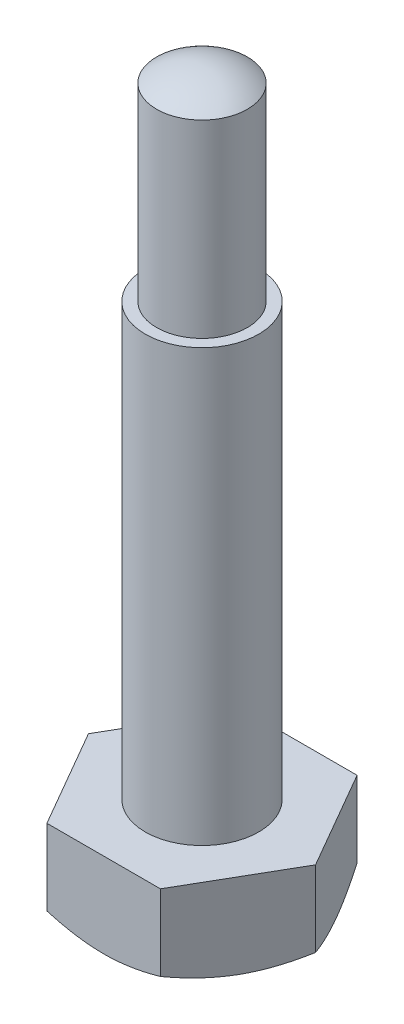
from build123d import *

# Parameters (mm, degrees)
SKETCH1_R           = 7.5
BOSS_EXTRUDE1_DEPTH = 11.2
SKETCH1_3_R         = 7.5
SKETCH1_3_R_2       = 6
BOSS_EXTRUDE2_DEPTH = 68.2
SKETCH1_4_R         = 6
BOSS_EXTRUDE3_DEPTH = 93.2
SKETCH4_OUTSIDE_W   = 338.072
SKETCH4_OUTSIDE_H   = 334.05
SKETCH4_OUTSIDE_R   = 13
CUT_EXTRUDE1_DEPTH  = 82.5
CUT_EXTRUDE1_DRAFT  = -60


with BuildPart() as part:
    # Sketch1 → Boss-Extrude1 (new body)
    with BuildSketch(Plane(origin=(0, 0, 0), x_dir=(1, 0, 0), z_dir=(0, 1, 0))):
        Polygon((15.011106999, 0), (7.505553499, 13), (-7.505553499, 13), (-15.011106999, 0), (-7.505553499, -13), (7.505553499, -13), align=None)
        with Locations(Location((0, 0, 0), (0, 0, 270))):
            Circle(SKETCH1_R, mode=Mode.SUBTRACT)
    extrude(amount=BOSS_EXTRUDE1_DEPTH)

    # Sketch1<3> → Boss-Extrude2 (add)
    with BuildSketch(Plane(origin=(0, 0, 0), x_dir=(1, 0, 0), z_dir=(0, 1, 0))):
        with Locations(Location((0, 0, 0), (0, 0, 270))):
            Circle(SKETCH1_3_R)
        with Locations(Location((0, 0, 0), (0, 0, 270))):
            Circle(SKETCH1_3_R_2, mode=Mode.SUBTRACT)
    extrude(amount=BOSS_EXTRUDE2_DEPTH)

    # Sketch1<4> → Boss-Extrude3 (add)
    with BuildSketch(Plane(origin=(0, 0, 0), x_dir=(1, 0, 0), z_dir=(0, 1, 0))):
        with Locations(Location((0, 0, 0), (0, 0, 270))):
            Circle(SKETCH1_4_R)
    extrude(amount=BOSS_EXTRUDE3_DEPTH)


with BuildPart() as cut_extrude1_tool:
    # Sketch4 outside → Cut-Extrude1 (with draft: the straight prism first)
    with BuildSketch(Plane.XZ):
        Rectangle(SKETCH4_OUTSIDE_W, SKETCH4_OUTSIDE_H)
        Circle(SKETCH4_OUTSIDE_R, mode=Mode.SUBTRACT)
    extrude(amount=-CUT_EXTRUDE1_DEPTH)
    # Cut-Extrude1: the draft: its side faces are tilted about the plane it starts from
    cut_extrude1_sides = [cut_extrude1_tool.faces().sort_by_distance(p)[0] for p in [
        (0, 41.25, -167.025),
        (169.036, 41.25, 0),
        (0, 41.25, 167.025),
        (-169.036, 41.25, 0),
        (-13, 41.25, 0),
    ]]
    draft(cut_extrude1_sides, Plane.XZ, CUT_EXTRUDE1_DRAFT)


with BuildPart() as part_1:
    add(part.part)

    # Cut-Extrude1: cut by cut_extrude1_tool
    add(cut_extrude1_tool.part, mode=Mode.SUBTRACT)

    # Sketch2 → Revolve2 (revolve)
    with BuildSketch(Plane.XY, mode=Mode.PRIVATE) as revolve2_sk:
        with BuildLine():
            Line((-6, 93.2), (0, 93.2))
            Line((0, 93.2), (0, 95.2))
            ThreePointArc((0, 95.2), (-3.16227766, 94.686832981), (-6, 93.2))
        make_face()
    revolve(revolve2_sk.sketch.rotate(Axis((0, 93.2, 0), (0, 1, 0)), 180), axis=Axis((0, 93.2, 0), (0, 1, 0)))


solid = part_1.part
